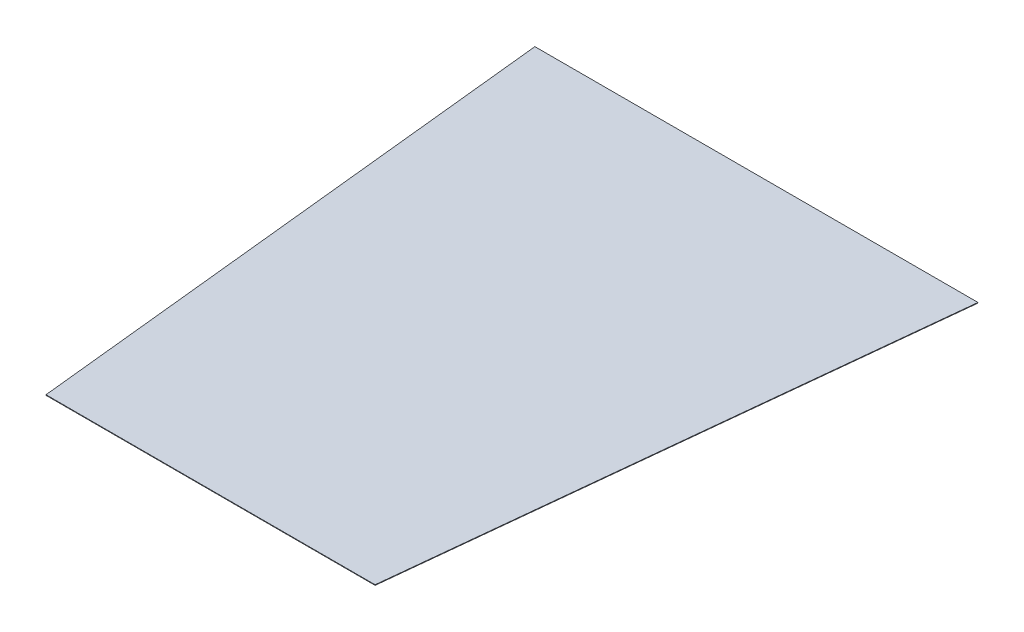
from build123d import *

# Parameters (mm, degrees)
CENTER_FLOOR_CLOSEOUT_DEPTH = 1


with BuildPart() as part:
    # Sketch1 → Center Floor Closeout (new body)
    with BuildSketch(Plane(origin=(0, 0, 0), x_dir=(1, 0, 0), z_dir=(0, 1, 0))):
        Polygon((-294.245, 0), (294.245, 0), (396.16, 976.103949831), (-396.16, 976.103949831), align=None)
    extrude(amount=CENTER_FLOOR_CLOSEOUT_DEPTH)


solid = part.part
